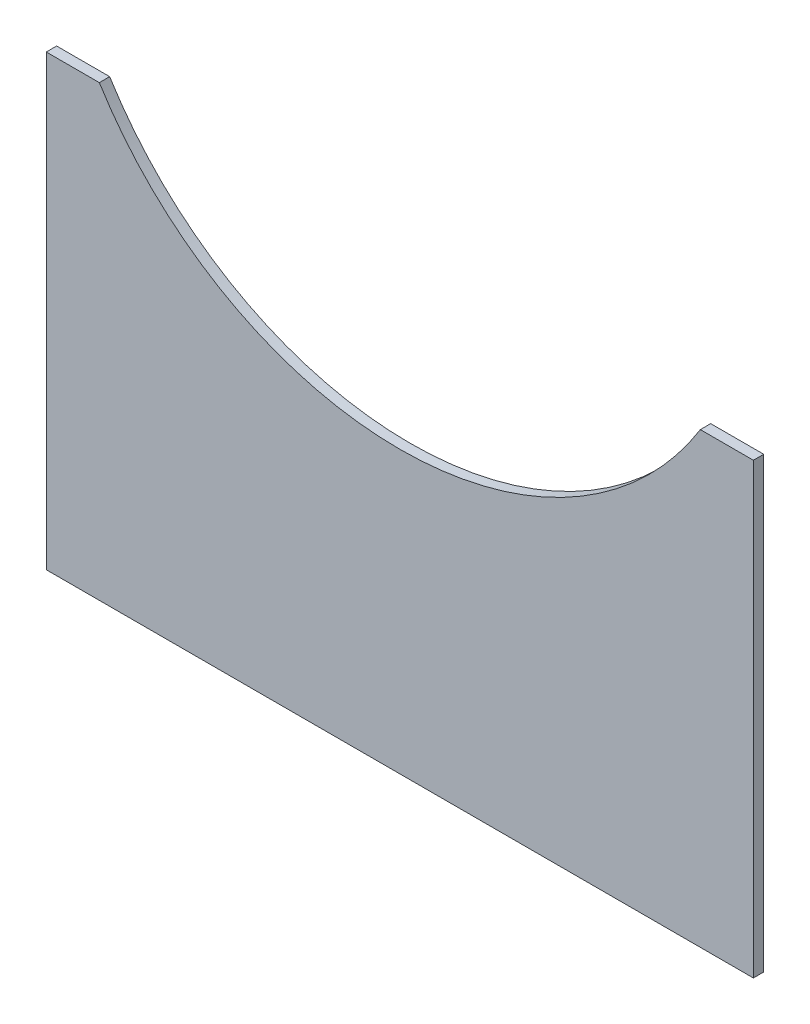
from build123d import *

# Parameters (mm, degrees)
BOSS_EXTRUDE1_DEPTH = 0.75


with BuildPart() as part:
    # Sketch1 → Boss-Extrude1 (new, symmetric)
    with BuildSketch(Plane.XY):
        with BuildLine():
            Line((51.25, 0), (-51.25, 0))
            Line((-51.25, 0), (-51.25, 65))
            Line((-51.25, 65), (-43.56102042, 65))
            ThreePointArc((-43.56102042, 65), (0, 40.75), (43.56102042, 65))
            Line((43.56102042, 65), (51.25, 65))
            Line((51.25, 65), (51.25, 0))
        make_face()
    extrude(amount=BOSS_EXTRUDE1_DEPTH, both=True)


solid = part.part
